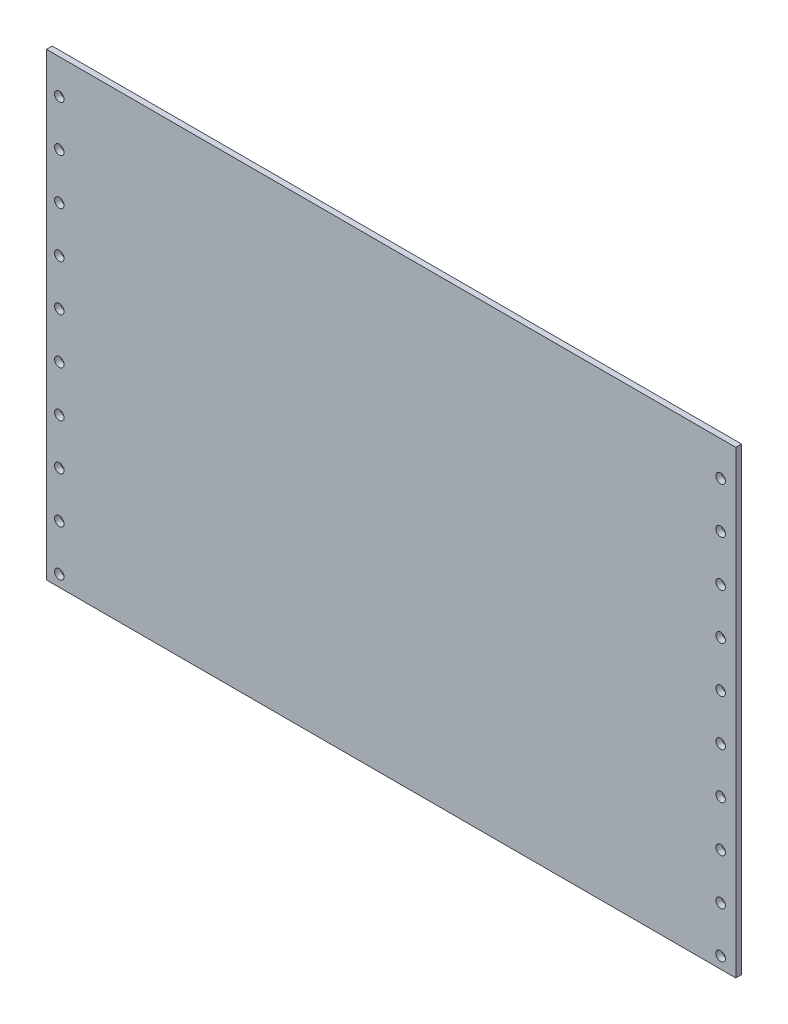
from build123d import *

# Parameters (mm, degrees)
SKETCH1_W                   = 381
SKETCH1_H                   = 254
BOSS_EXTRUDE1_DEPTH         = 3.175
F_5_0_2055_DIAMETER_HOLE1_D = 5.2197


with BuildPart() as part:
    # Sketch1 → Boss-Extrude1 (new body)
    with BuildSketch(Plane.XY):
        Rectangle(SKETCH1_W, SKETCH1_H)
    extrude(amount=BOSS_EXTRUDE1_DEPTH)

    # #5 (0.2055) Diameter Hole1 (through all)
    with Locations(Plane.XY.offset(3.175)):
        with Locations((-183.388, 107.95), (-183.388, 82.55), (-183.388, 57.15), (-183.388, 31.75), (-183.388, 6.35), (-183.388, -19.05), (-183.388, -44.45), (-183.388, -69.85), (-183.388, -120.65), (-183.388, -95.25), (182.118, -120.65), (182.118, -95.25), (182.118, -69.85), (182.118, -44.45), (182.118, -19.05), (182.118, 6.35), (182.118, 31.75), (182.118, 57.15), (182.118, 82.55), (182.118, 107.95)):
            Hole(F_5_0_2055_DIAMETER_HOLE1_D / 2)


solid = part.part
